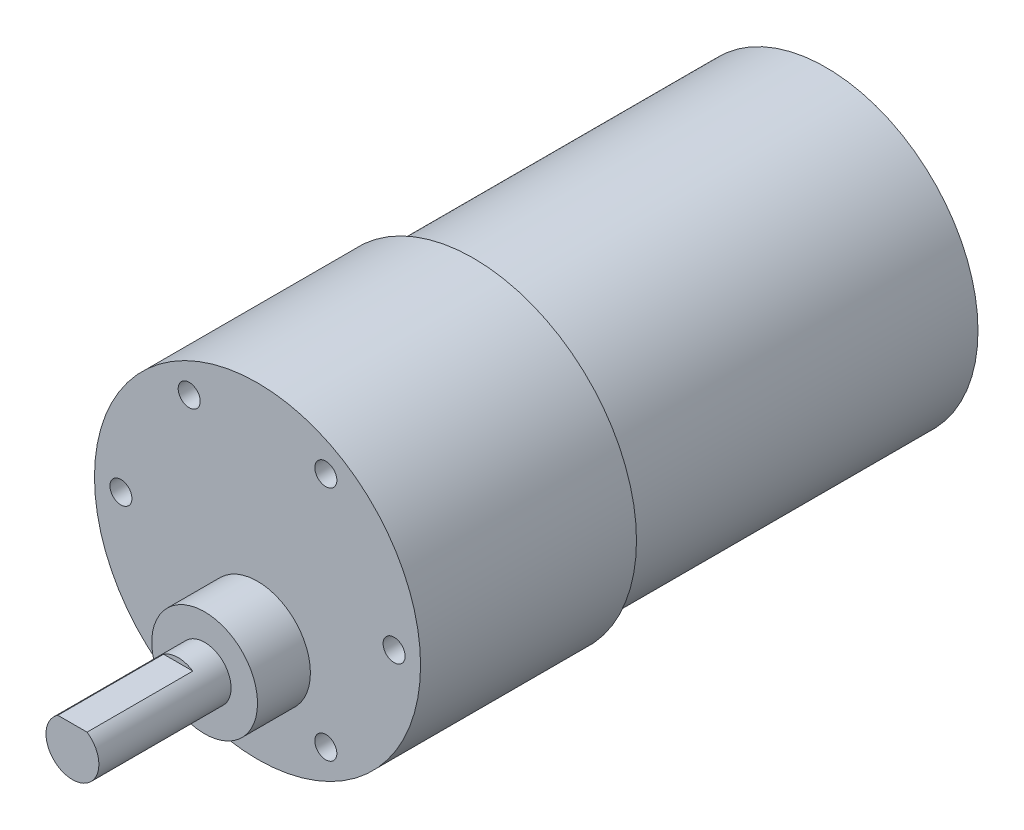
from build123d import *

# Parameters (mm, degrees)
SKETCH1_R           = 17.25
BOSS_EXTRUDE1_DEPTH = 40
SKETCH2_R           = 18.5
BOSS_EXTRUDE2_DEPTH = 24.5
SKETCH3_R           = 6
BOSS_EXTRUDE3_DEPTH = 6
SKETCH4_R           = 3
BOSS_EXTRUDE4_DEPTH = 15
CUT_EXTRUDE1_START  = -12
CUT_EXTRUDE1_DEPTH  = 12
SKETCH7_R           = 1.25
CUT_EXTRUDE2_DEPTH  = 5


with BuildPart() as part:
    # Sketch1 → Boss-Extrude1 (new body)
    with BuildSketch(Plane.XY):
        Circle(SKETCH1_R)
    extrude(amount=BOSS_EXTRUDE1_DEPTH)

    # Sketch2 → Boss-Extrude2 (add)
    with BuildSketch(Plane.XY.offset(40)):
        Circle(SKETCH2_R)
    extrude(amount=BOSS_EXTRUDE2_DEPTH)

    # Sketch3 → Boss-Extrude3 (add)
    with BuildSketch(Plane.XY.offset(64.5)):
        with Locations((0, -7)):
            Circle(SKETCH3_R)
    extrude(amount=BOSS_EXTRUDE3_DEPTH)

    # Sketch4 → Boss-Extrude4 (add)
    with BuildSketch(Plane.XY.offset(70.5)):
        with Locations((0, -7)):
            Circle(SKETCH4_R)
    extrude(amount=BOSS_EXTRUDE4_DEPTH)

    # Sketch5 → Cut-Extrude1 (cut)
    with BuildSketch(Plane.XY.offset(85.5).offset(CUT_EXTRUDE1_START)):
        with BuildLine():
            Line((0, -4.5), (1.658312395, -4.5))
            ThreePointArc((1.658312395, -4.5), (0, -4), (-1.658312395, -4.5))
            Line((-1.658312395, -4.5), (0, -4.5))
        make_face()
    extrude(amount=CUT_EXTRUDE1_DEPTH, mode=Mode.SUBTRACT)

    # Sketch7 → Cut-Extrude2 (cut)
    with BuildSketch(Plane.XY.offset(64.5)):
        with Locations((-15.5, 1.1641e-05)):
            Circle(SKETCH7_R)
        with Locations((-7.75, 13.4234054)):
            Circle(SKETCH7_R)
        with Locations((7.75, 13.4234054)):
            Circle(SKETCH7_R)
        with Locations((15.5, 1.1641e-05)):
            Circle(SKETCH7_R)
        with Locations((7.75, -13.423382117)):
            Circle(SKETCH7_R)
        with Locations((-7.75, -13.423382117)):
            Circle(SKETCH7_R)
    extrude(amount=-CUT_EXTRUDE2_DEPTH, mode=Mode.SUBTRACT)


solid = part.part
